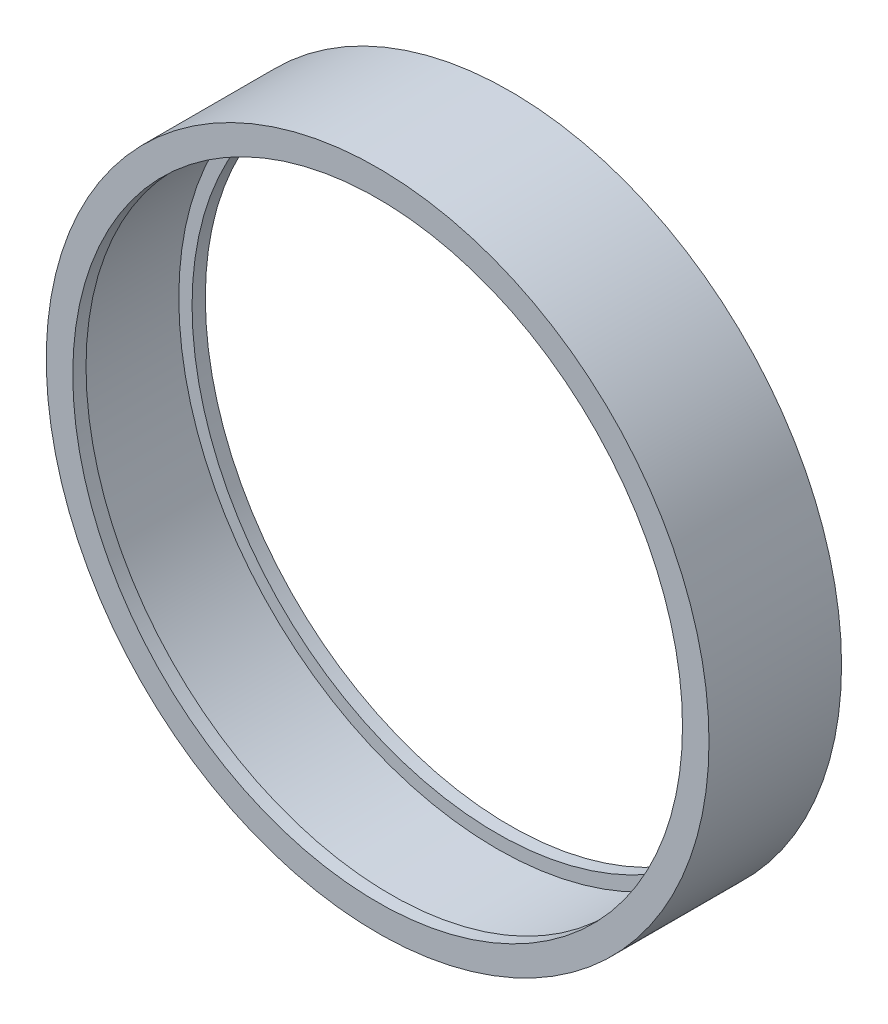
from build123d import *

# Parameters (mm, degrees)
SKETCH1_R               = 50
BOSS_EXTRUDE1_DEPTH     = 20
CUT_EXTRUDE4_DEPTH      = 74.484692283
CUT_EXTRUDE4_DEPTH_BACK = 74.484692283
SKETCH3_R               = 46
SKETCH4_R               = 48
CUT_EXTRUDE5_DEPTH      = 8


with BuildPart() as part:
    # Sketch1 → Boss-Extrude1 (new body)
    with BuildSketch(Plane.XY):
        Circle(SKETCH1_R)
    extrude(amount=BOSS_EXTRUDE1_DEPTH)

    # Sketch3 → Cut-Extrude4 (cut, two sides: drawn at the far end of the back side and taken through both)
    with BuildSketch(Plane(origin=(0, 0, 0), x_dir=(-1, 0, 0), z_dir=(0, 0, -1)).offset(-CUT_EXTRUDE4_DEPTH_BACK)):
        Circle(SKETCH3_R)
    extrude(amount=CUT_EXTRUDE4_DEPTH + CUT_EXTRUDE4_DEPTH_BACK, mode=Mode.SUBTRACT)

    # Sketch4 → Cut-Extrude5 (cut, symmetric)
    with BuildSketch(Plane(origin=(0, 0, 10), x_dir=(-1, 0, 0), z_dir=(0, 0, -1))):
        Circle(SKETCH4_R)
    extrude(amount=CUT_EXTRUDE5_DEPTH, both=True, mode=Mode.SUBTRACT)


solid = part.part
